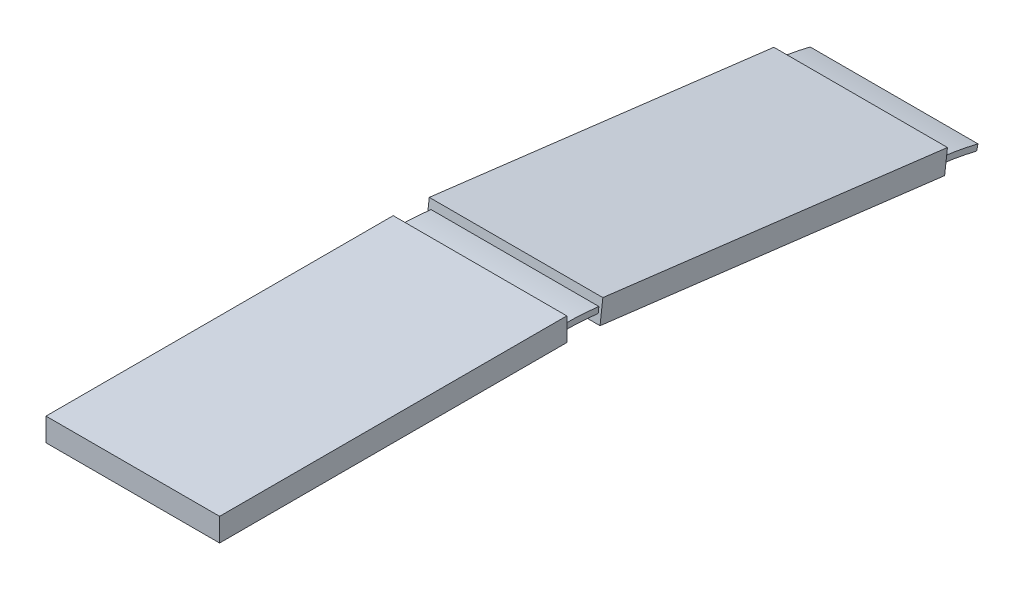
from build123d import *

# Parameters (mm, degrees)
SKETCH1_W           = 1.5
SKETCH1_H           = 3
BOSS_EXTRUDE1_DEPTH = 0.1
BOSS_EXTRUDE3_DEPTH = 0.725
BOSS_EXTRUDE4_DEPTH = 0.75
BOSS_EXTRUDE5_DEPTH = 0.725


with BuildPart() as part:
    # Sketch1 → Boss-Extrude1 (new, symmetric)
    with BuildSketch(Plane(origin=(0, 0, 0), x_dir=(1, 0, 0), z_dir=(0, 1, 0))):
        Rectangle(SKETCH1_W, SKETCH1_H)
    extrude(amount=BOSS_EXTRUDE1_DEPTH, both=True)

    # Sketch3 → Boss-Extrude3 (add, symmetric)
    with BuildSketch(Plane(origin=(0, 0, 0), x_dir=(0, 0, -1), z_dir=(1, 0, 0))):
        with BuildLine():
            Line((1.5, 0.025), (1.5, -0.025))
            ThreePointArc((1.5, -0.025), (1.648473787, -0.029536284), (1.796393706, -0.043128216))
            Line((1.796393706, -0.043128216), (1.802487173, 0.006499092))
            ThreePointArc((1.802487173, 0.006499092), (1.651526213, 0.020370455), (1.5, 0.025))
        make_face()
    extrude(amount=BOSS_EXTRUDE3_DEPTH, both=True)

    # Sketch4 → Boss-Extrude4 (add, symmetric)
    with BuildSketch(Plane(origin=(0, 0, 0), x_dir=(0, 0, -1), z_dir=(1, 0, 0))):
        Polygon((1.787253505, -0.117569177), (1.811627374, 0.080940053), (4.789265829, -0.284667977), (4.76489196, -0.483177207), align=None)
    extrude(amount=BOSS_EXTRUDE4_DEPTH, both=True)

    # Sketch6 → Boss-Extrude5 (add, symmetric)
    with BuildSketch(Plane(origin=(0, 0, 0), x_dir=(0, 0, -1), z_dir=(1, 0, 0))):
        with BuildLine():
            Line((4.780125628, -0.359108938), (4.774032161, -0.408736246))
            ThreePointArc((4.774032161, -0.408736246), (4.920846412, -0.43133312), (5.066007319, -0.462850643))
            Line((5.066007319, -0.462850643), (5.078103414, -0.414335857))
            ThreePointArc((5.078103414, -0.414335857), (4.929958189, -0.382170375), (4.780125628, -0.359108938))
        make_face()
    extrude(amount=BOSS_EXTRUDE5_DEPTH, both=True)


solid = part.part
